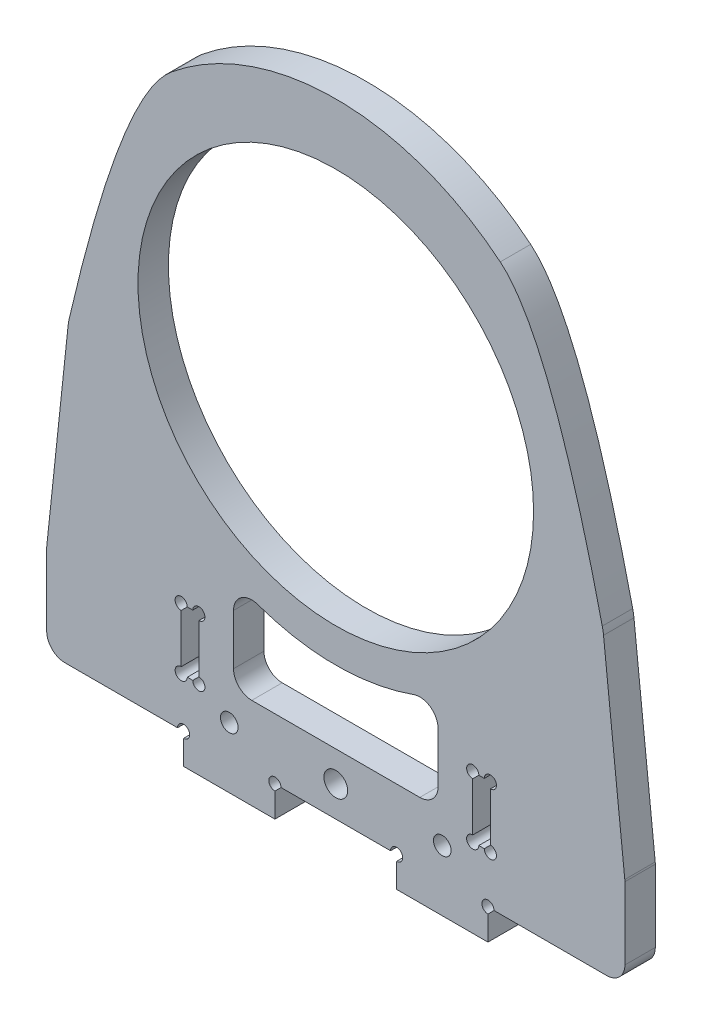
from build123d import *

# Parameters (mm, degrees)
SKETCH_1_R          = 32.5
EXTRUDE_1_DEPTH     = 5
SKETCH_2_W          = 15
SKETCH_2_H          = 5
EXTRUDE_2_DEPTH     = 5
SKETCH_3_R          = 1
CUT_EXTRUDE_1_DEPTH = 114.081828779
SKETCH_4_R          = 1.95
SKETCH_4_R_2        = 1.45
CUT_EXTRUDE_2_DEPTH = 114.081828779
FILLET_1_R          = 3
SKETCH_5_W          = 2.9
SKETCH_5_H          = 10
CUT_EXTRUDE_3_DEPTH = 114.081828779
SKETCH_6_R          = 1
CUT_EXTRUDE_4_DEPTH = 114.081828779
CUT_EXTRUDE_5_DEPTH = 114.081828779
FILLET_3_R          = 10
FILLET_4_R          = 3


with BuildPart() as part:
    # 草图1 → 凸台-拉伸1 (new body)
    with BuildSketch(Plane.XY):
        with BuildLine():
            Line((-42.263952975, 64.473061473), (-47.5, 15))
            Line((-47.5, 15), (-47.5, 0))
            Line((-47.5, 0), (47.5, 0))
            Line((47.5, 0), (47.5, 15))
            Line((47.5, 15), (42.263952975, 64.473061473))
            ThreePointArc((42.263952975, 64.473061473), (0, 102.5), (-42.263952975, 64.473061473))
        make_face()
        with Locations((0, 60)):
            Circle(SKETCH_1_R, mode=Mode.SUBTRACT)
    extrude(amount=EXTRUDE_1_DEPTH)

    # 草图2 → 凸台-拉伸2 (add)
    with BuildSketch(Plane.XY.offset(5)):
        with Locations((-17.5, -2.5)):
            Rectangle(SKETCH_2_W, SKETCH_2_H)
        with Locations((17.5, -2.5)):
            Rectangle(SKETCH_2_W, SKETCH_2_H)
    extrude(amount=-EXTRUDE_2_DEPTH)

    # 草图3 → 切除-拉伸1 (cut, through all)
    with BuildSketch(Plane.XY.offset(5)):
        with Locations((-25, 0)):
            Circle(SKETCH_3_R)
        with Locations((-10, 0)):
            Circle(SKETCH_3_R)
        with Locations((10, 0)):
            Circle(SKETCH_3_R)
        with Locations((25, 0)):
            Circle(SKETCH_3_R)
    extrude(amount=-CUT_EXTRUDE_1_DEPTH, mode=Mode.SUBTRACT)

    # 草图4 → 切除-拉伸2 (cut, through all)
    with BuildSketch(Plane.XY.offset(5)):
        with Locations((0, 5)):
            Circle(SKETCH_4_R)
        with Locations((-17.5, 5)):
            Circle(SKETCH_4_R_2)
        with Locations((17.5, 5)):
            Circle(SKETCH_4_R_2)
    extrude(amount=-CUT_EXTRUDE_2_DEPTH, mode=Mode.SUBTRACT)

    # 圆角1
    fillet_1_edges = [part.edges().sort_by_distance(p)[0] for p in [
        (47.5, 15, 2.5),
        (47.5, 0, 2.5),
        (-47.5, 0, 2.5),
        (-47.5, 15, 2.5),
    ]]
    fillet(fillet_1_edges, radius=FILLET_1_R)

    # 草图5 → 切除-拉伸3 (cut, through all)
    with BuildSketch(Plane.XY.offset(5)):
        with Locations((-23.95, 13)):
            Rectangle(SKETCH_5_W, SKETCH_5_H)
        with Locations((23.95, 13)):
            Rectangle(SKETCH_5_W, SKETCH_5_H)
    extrude(amount=-CUT_EXTRUDE_3_DEPTH, mode=Mode.SUBTRACT)

    # 草图6 → 切除-拉伸4 (cut, through all)
    with BuildSketch(Plane.XY.offset(5)):
        with Locations((-25.4, 18)):
            Circle(SKETCH_6_R)
        with Locations((-22.5, 18)):
            Circle(SKETCH_6_R)
        with Locations((-22.5, 8)):
            Circle(SKETCH_6_R)
        with Locations((-25.4, 8)):
            Circle(SKETCH_6_R)
        with Locations((22.5, 18)):
            Circle(SKETCH_6_R)
        with Locations((25.4, 18)):
            Circle(SKETCH_6_R)
        with Locations((25.4, 8)):
            Circle(SKETCH_6_R)
        with Locations((22.5, 8)):
            Circle(SKETCH_6_R)
    extrude(amount=-CUT_EXTRUDE_4_DEPTH, mode=Mode.SUBTRACT)

    # 草图7 → 切除-拉伸5 (cut, through all)
    with BuildSketch(Plane.XY.offset(5)):
        with BuildLine():
            Line((-16.805922522, 25.815370212), (-16.805922522, 9.999999776))
            Line((-16.805922522, 9.999999776), (16.805922522, 9.999999776))
            Line((16.805922522, 9.999999776), (16.805922522, 25.815370212))
            ThreePointArc((16.805922522, 25.815370212), (0, 21.907639276), (-16.805922522, 25.815370212))
        make_face()
        with BuildLine():
            Line((-46.54378056, 48.762700401), (-46.54378056, 92.803684493))
            Line((-46.54378056, 92.803684493), (-27.021626223, 92.803684493))
            add(Edge.make_bspline(
                [(-27.021626223, 92.803684493), (-35.335790396, 85.954995386), (-43.926679859, 48.762700401)],
                knots=[0, 0, 0, 1, 1, 1], degree=2))
            Line((-43.926679859, 48.762700401), (-46.54378056, 48.762700401))
        make_face()
        with BuildLine():
            Line((46.54378056, 92.803684493), (27.021626223, 92.803684493))
            add(Edge.make_bspline(
                [(27.021626223, 92.803684493), (35.335790396, 85.954995386), (43.926679859, 48.762700401)],
                knots=[0, 0, 0, 1, 1, 1], degree=2))
            Line((43.926679859, 48.762700401), (46.54378056, 48.762700401))
            Line((46.54378056, 48.762700401), (46.54378056, 92.803684493))
        make_face()
    extrude(amount=-CUT_EXTRUDE_5_DEPTH, mode=Mode.SUBTRACT)

    # 圆角3
    fillet_3_edges = [part.edges().sort_by_distance(p)[0] for p in [
        (-43.926679859, 48.762700401, 2.5),
        (43.926679859, 48.762700401, 2.5),
    ]]
    fillet(fillet_3_edges, radius=FILLET_3_R)

    # 圆角4
    fillet_4_edges = [part.edges().sort_by_distance(p)[0] for p in [
        (16.805922522, 25.815370212, 2.5),
        (16.805922522, 9.999999776, 2.5),
        (-16.805922522, 9.999999776, 2.5),
        (-16.805922522, 25.815370212, 2.5),
    ]]
    fillet(fillet_4_edges, radius=FILLET_4_R)


solid = part.part
